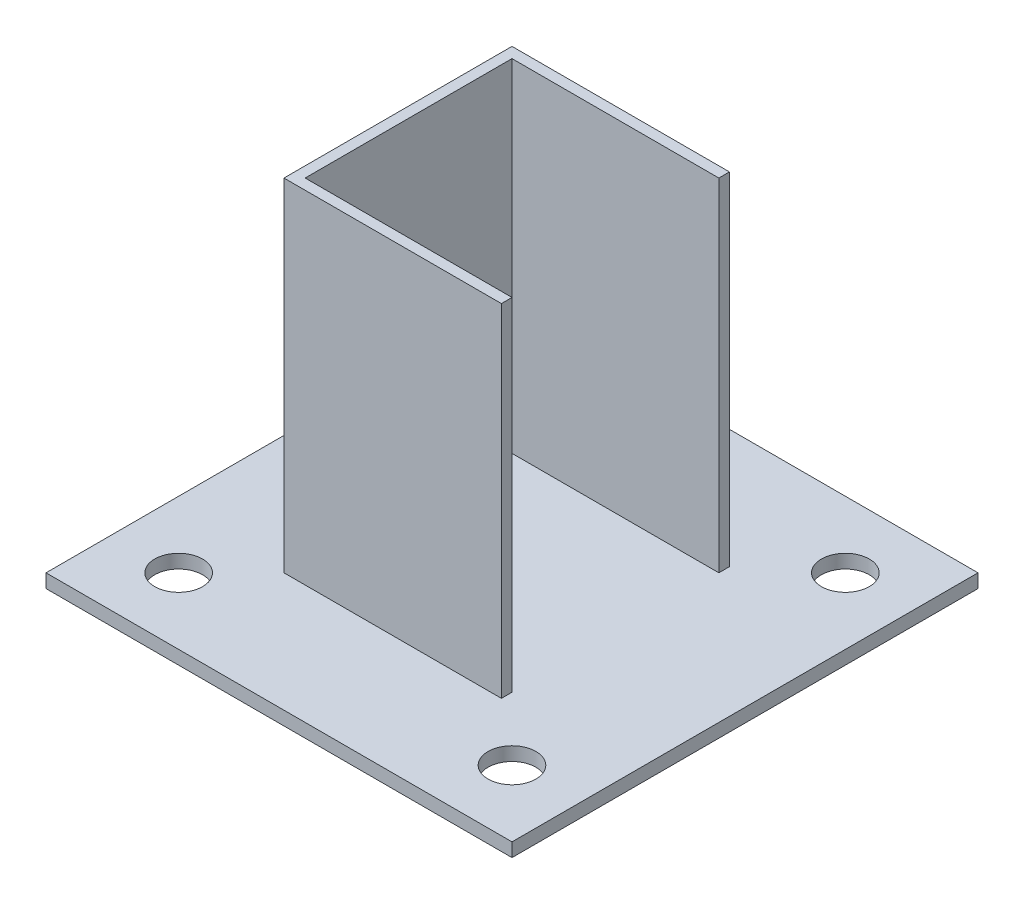
from build123d import *

# Parameters (mm, degrees)
SKETCH_1_W          = 136.3
SKETCH_1_H          = 136.3
EXTRUDE_1_DEPTH     = 4
EXTRUDE_2_DEPTH     = 100
CUT_EXTRUDE_1_DEPTH = 100
SKETCH_5_R          = 7
CUT_EXTRUDE_2_DEPTH = 100


with BuildPart() as part:
    # 草图1 → 凸台-拉伸1 (new body)
    with BuildSketch(Plane(origin=(0, 0, 0), x_dir=(1, 0, 0), z_dir=(0, 1, 0))):
        Rectangle(SKETCH_1_W, SKETCH_1_H)
    extrude(amount=EXTRUDE_1_DEPTH)

    # 草图2 → 凸台-拉伸2 (add)
    with BuildSketch(Plane(origin=(0, 4, 0), x_dir=(1, 0, 0), z_dir=(0, 1, 0))):
        Polygon((30.25, 30.25), (-30.25, 30.25), (-30.25, -30.25), (30.25, -30.25), (30.25, -33.35), (-33.35, -33.35), (-33.35, -1.55), (-63.85, -1.55), (-63.85, 1.55), (-33.35, 1.55), (-33.35, 33.35), (30.25, 33.35), align=None)
    extrude(amount=EXTRUDE_2_DEPTH)

    # 草图3 → 切除-拉伸1 (cut)
    with BuildSketch(Plane.XY.offset(1.55)):
        Polygon((-63.85, 4), (-33.35, 72), (-33.35, 104), (-63.85, 104), align=None)
    extrude(amount=-CUT_EXTRUDE_1_DEPTH, mode=Mode.SUBTRACT)

    # 草图5 → 切除-拉伸2 (cut)
    with BuildSketch(Plane(origin=(0, 4, 0), x_dir=(1, 0, 0), z_dir=(0, 1, 0))):
        with Locations(Location((48.75, 48.75, 0), (0, 0, 270))):
            Circle(SKETCH_5_R)
        with Locations(Location((48.75, -48.75, 0), (0, 0, 270))):
            Circle(SKETCH_5_R)
        with Locations(Location((-48.75, -48.75, 0), (0, 0, 270))):
            Circle(SKETCH_5_R)
        with Locations(Location((-48.75, 48.75, 0), (0, 0, 270))):
            Circle(SKETCH_5_R)
    extrude(amount=-CUT_EXTRUDE_2_DEPTH, mode=Mode.SUBTRACT)


solid = part.part
